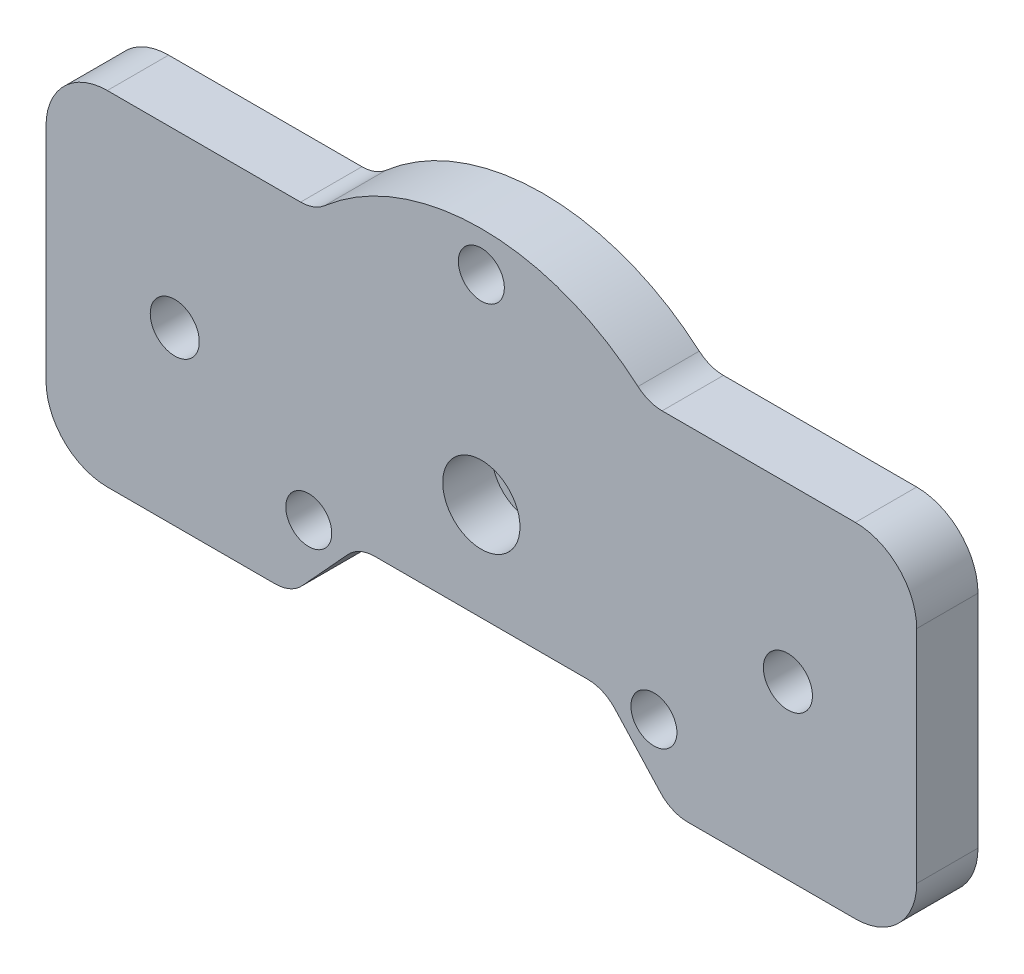
from build123d import *

# Parameters (mm, degrees)
SKETCH_1_R          = 1.875
SKETCH_1_R_2        = 1.25
EXTRUDE_1_DEPTH     = 5
FILLET_1_R          = 3
FILLET_2_R          = 5
FILLET_3_R          = 3
SKETCH_2_R          = 3.15
CUT_EXTRUDE_1_DEPTH = 4
SKETCH_3_R          = 2
CUT_EXTRUDE_2_DEPTH = 79.665430781


with BuildPart() as part:
    # Эскиз1 → Бобышка-Вытянуть1 (new body)
    with BuildSketch(Plane.XY):
        with BuildLine():
            Line((0, 0), (20, 0))
            Line((20, 0), (25.5, 6.006432896))
            Line((25.5, 6.006432896), (45.5, 6.006432896))
            Line((45.5, 6.006432896), (51, 0))
            Line((51, 0), (71, 0))
            Line((71, 0), (71, 28))
            Line((71, 28), (49.07387196, 28))
            ThreePointArc((49.07387196, 28), (35.5, 33.5), (21.92612804, 28))
            Line((21.92612804, 28), (0, 28))
            Line((0, 28), (0, 0))
        make_face()
        with Locations((35.5, 30.25)):
            Circle(SKETCH_1_R, mode=Mode.SUBTRACT)
        with Locations((35.5, 14)):
            Circle(SKETCH_1_R_2, mode=Mode.SUBTRACT)
        with Locations((49.572912812, 5.875)):
            Circle(SKETCH_1_R, mode=Mode.SUBTRACT)
        with Locations((21.427087189, 5.875)):
            Circle(SKETCH_1_R, mode=Mode.SUBTRACT)
    extrude(amount=EXTRUDE_1_DEPTH)

    # Скругление1
    fillet_1_edges = [part.edges().sort_by_distance(p)[0] for p in [
        (21.92612804, 28, 2.5),
        (49.07387196, 28, 2.5),
        (45.5, 6.006432896, 2.5),
        (25.5, 6.006432896, 2.5),
    ]]
    fillet(fillet_1_edges, radius=FILLET_1_R)

    # Скругление2
    fillet_2_edges = [part.edges().sort_by_distance(p)[0] for p in [
        (0, 28, 2.5),
        (71, 28, 2.5),
        (71, 0, 2.5),
        (0, 0, 2.5),
    ]]
    fillet(fillet_2_edges, radius=FILLET_2_R)

    # Скругление3
    fillet_3_edges = [part.edges().sort_by_distance(p)[0] for p in [
        (51, 0, 2.5),
        (20, 0, 2.5),
    ]]
    fillet(fillet_3_edges, radius=FILLET_3_R)

    # Эскиз2 → Вырез-Вытянуть1 (cut)
    with BuildSketch(Plane.XY.offset(5)):
        with Locations((35.5, 14)):
            Circle(SKETCH_2_R)
    extrude(amount=-CUT_EXTRUDE_1_DEPTH, mode=Mode.SUBTRACT)

    # Эскиз3 → Вырез-Вытянуть2 (cut, through all)
    with BuildSketch(Plane(origin=(0, 0, 0), x_dir=(-1, 0, 0), z_dir=(0, 0, -1))):
        with Locations((-10.5, 14)):
            Circle(SKETCH_3_R)
        with Locations((-60.5, 14)):
            Circle(SKETCH_3_R)
    extrude(amount=-CUT_EXTRUDE_2_DEPTH, mode=Mode.SUBTRACT)


solid = part.part
